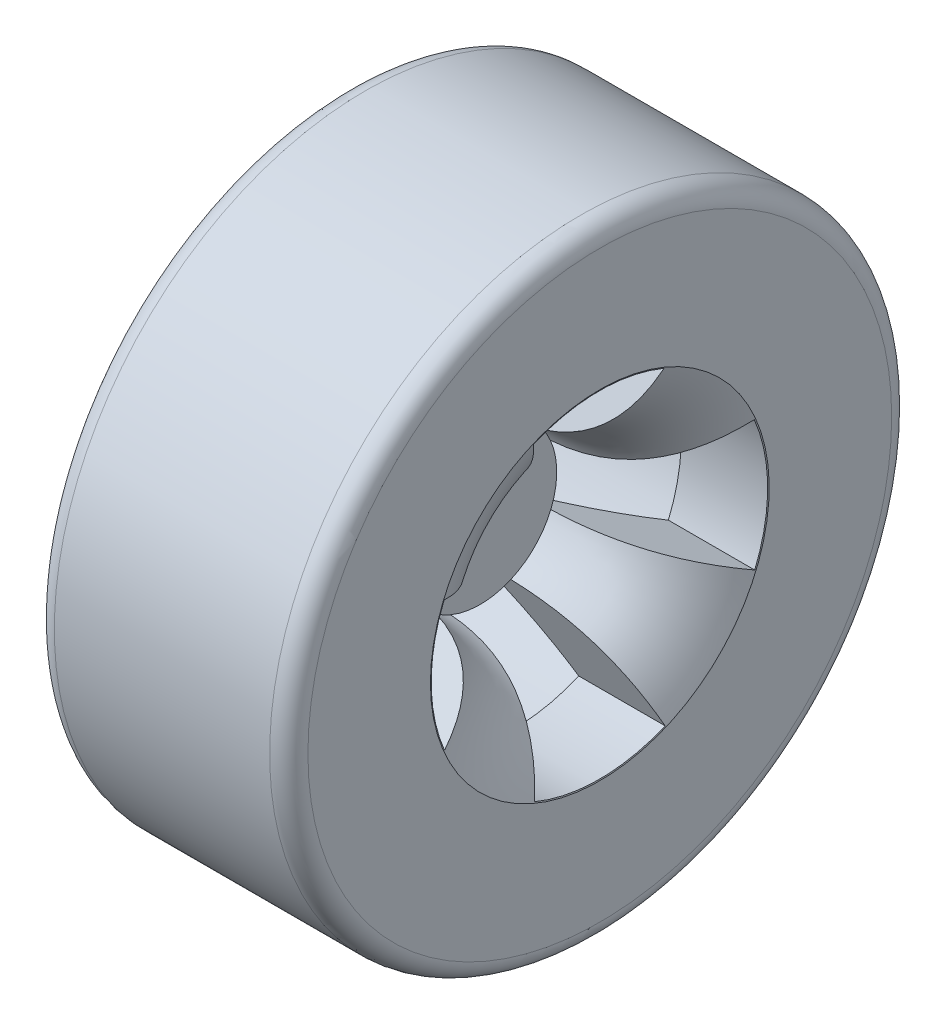
from build123d import *

# Parameters (mm, degrees)
SKETCH_1_R          = 32.5
EXTRUDE_1_DEPTH     = 26.5
SKETCH_2_R          = 23
CUT_EXTRUDE_1_DEPTH = 26.5
CUT_EXTRUDE_START   = -26.5
CUT_EXTRUDE_2_DEPTH = 26.5
FILLET_1_R          = 2


with BuildPart() as part:
    # 草图1 → 凸台-拉伸1 (new body)
    with BuildSketch(Plane(origin=(0, 0, 0), x_dir=(0, 0, -1), z_dir=(1, 0, 0))):
        Circle(SKETCH_1_R)
    extrude(amount=EXTRUDE_1_DEPTH)

    # 草图2 → 切除-拉伸1 (cut)
    with BuildSketch(Plane.ZY):
        Circle(SKETCH_2_R)
    extrude(amount=-CUT_EXTRUDE_1_DEPTH, mode=Mode.SUBTRACT)

    # 草图3 → 旋转2 (revolve)
    with BuildSketch(Plane.XY, mode=Mode.PRIVATE) as revolve_2_sk:
        Polygon((8, 2), (8, 0), (14, 0), (14, 8), (11, 8), (8, 8), (8, 5.5), (-2, 5.5), (-2, 2), align=None)
        with BuildLine():
            Line((11, 8), (14, 8))
            add(Edge.make_bspline(
                [(14, 8), (23.420598, 8.526198), (26.5, 17.699792)],
                knots=[0, 0, 0, 1, 1, 1], degree=2))
            Line((26.5, 17.699792), (26.5, 23))
            Line((26.5, 23), (19.206037, 23))
            add(Edge.make_bspline(
                [(11, 8), (17.176221, 14.336446), (19.206037, 23)],
                knots=[0, 0, 0, 1, 1, 1], degree=2))
        make_face()
    revolve(revolve_2_sk.sketch.rotate(Axis((26.5, 0, 0), (-1, 0, 0)), 270), axis=Axis((26.5, 0, 0), (-1, 0, 0)))

    # 草图4 → 切除-拉伸2 (cut)
    with BuildSketch(Plane(origin=(26.5, 0, 0), x_dir=(0, 0, -1), z_dir=(1, 0, 0)).offset(CUT_EXTRUDE_START)):
        with BuildLine():
            Line((16.230217, -6.759498), (7.377987, -3.092784))
            ThreePointArc((7.377987, -3.092784), (7.999773, 0.060211), (7.330597, 3.20349))
            Line((7.330597, 3.20349), (16.183541, 6.870499))
            ThreePointArc((16.183541, 6.870499), (17.581443, 0.060208), (16.230217, -6.759498))
        make_face()
        with BuildLine():
            Line((-6.759498, -16.230217), (-3.092784, -7.377987))
            ThreePointArc((-3.092784, -7.377987), (0.060211, -7.999773), (3.20349, -7.330597))
            Line((3.20349, -7.330597), (6.870499, -16.183541))
            ThreePointArc((6.870499, -16.183541), (0.060208, -17.581443), (-6.759498, -16.230217))
        make_face()
        with BuildLine():
            Line((-6.870499, 16.183541), (-3.20349, 7.330597))
            ThreePointArc((-3.20349, 7.330597), (-0.060211, 7.999773), (3.092784, 7.377987))
            Line((3.092784, 7.377987), (6.759498, 16.230217))
            ThreePointArc((6.759498, 16.230217), (-0.060208, 17.581443), (-6.870499, 16.183541))
        make_face()
        with BuildLine():
            Line((-16.230217, 6.759498), (-7.377987, 3.092784))
            ThreePointArc((-7.377987, 3.092784), (-7.999773, -0.060211), (-7.330597, -3.20349))
            Line((-7.330597, -3.20349), (-16.183541, -6.870499))
            ThreePointArc((-16.183541, -6.870499), (-17.581443, -0.060208), (-16.230217, 6.759498))
        make_face()
    extrude(amount=CUT_EXTRUDE_2_DEPTH, mode=Mode.SUBTRACT)

    # 圆角1
    fillet_1_edges = [part.edges().sort_by_distance(p)[0] for p in [
        (0, 0, 32.5),
        (26.5, 0, 32.5),
    ]]
    fillet(fillet_1_edges, radius=FILLET_1_R)


solid = part.part
